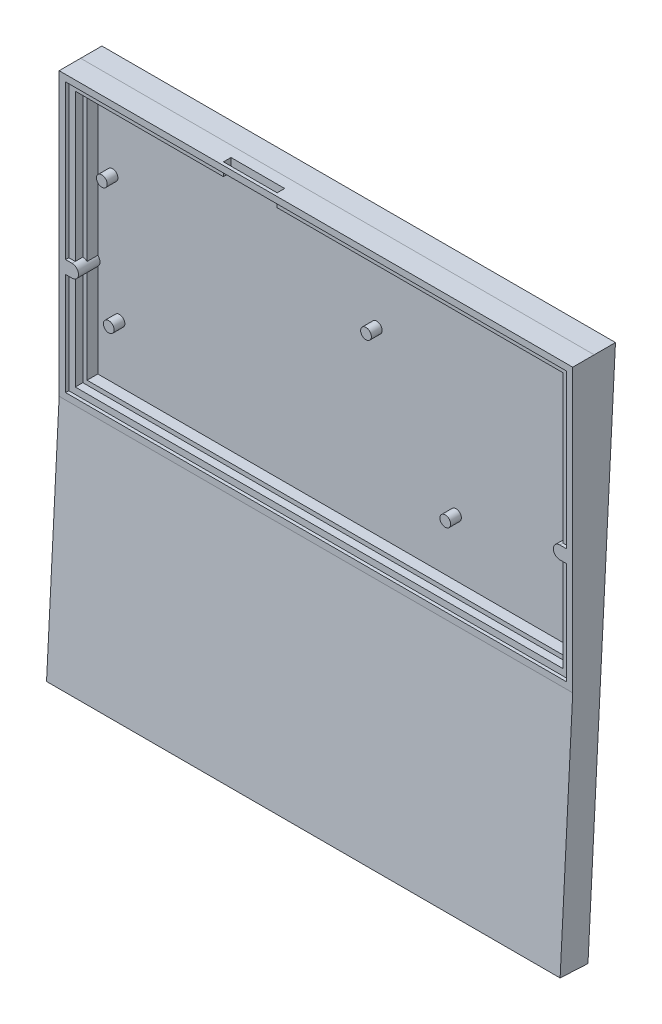
from build123d import *

# Parameters (mm, degrees)
MODEL_W             = 239.114
MODEL_H             = 131.298938207
EXTRUDE_2_DEPTH     = 10
EXTRUDE_3_DEPTH     = 8.5
EXTRUDE_4_DEPTH     = 5
SKETCH_3_R          = 2.5
EXTRUDE_5_DEPTH     = 5
EXTRUDE_5_2_DEPTH   = 5
EXTRUDE_5_3_DEPTH   = 5
EXTRUDE_5_4_DEPTH   = 5
EXTRUDE_6_DEPTH     = 239.114
SKETCH_5_W          = 25
SKETCH_5_H          = 5.998631207
CUT_EXTRUDE_1_DEPTH = 3.5


with BuildPart() as part:
    # Model → 凸台-拉伸2 (new body)
    with BuildSketch(Plane.XY):
        with Locations((559.31883528, 226.885059923)):
            Rectangle(MODEL_W, MODEL_H)
        with BuildLine():
            Line((442.76183528, 289.535897819), (675.87583528, 289.535897819))
            Line((675.87583528, 289.535897819), (675.87583528, 217.861297819))
            Line((675.87583528, 217.861297819), (672.87583528, 217.861297819))
            ThreePointArc((672.87583528, 217.861297819), (671.805369011, 217.663814896), (670.87583528, 217.097365797))
            ThreePointArc((670.87583528, 217.097365797), (669.87583528, 214.861297819), (670.87583528, 212.625229842))
            ThreePointArc((670.87583528, 212.625229842), (671.805369011, 212.058780742), (672.87583528, 211.861297819))
            Line((672.87583528, 211.861297819), (675.87583528, 211.861297819))
            Line((675.87583528, 211.861297819), (675.87583528, 164.235590819))
            Line((675.87583528, 164.235590819), (442.76183528, 164.235590819))
            Line((442.76183528, 164.235590819), (442.76183528, 211.861297819))
            Line((442.76183528, 211.861297819), (445.76183528, 211.861297819))
            ThreePointArc((445.76183528, 211.861297819), (446.832301549, 212.058780742), (447.76183528, 212.625229842))
            ThreePointArc((447.76183528, 212.625229842), (448.76183528, 214.861297819), (447.76183528, 217.097365797))
            ThreePointArc((447.76183528, 217.097365797), (446.832301549, 217.663814896), (445.76183528, 217.861297819))
            Line((445.76183528, 217.861297819), (442.76183528, 217.861297819))
            Line((442.76183528, 217.861297819), (442.76183528, 289.535897819))
        make_face(mode=Mode.SUBTRACT)
    extrude(amount=EXTRUDE_2_DEPTH)

    # Model<4> → 凸台-拉伸3 (add)
    with BuildSketch(Plane.XY):
        Polygon((445.76183528, 167.235590819), (445.76183528, 211.861297819), (442.76183528, 211.861297819), (442.76183528, 164.235590819), (675.87583528, 164.235590819), (675.87583528, 211.861297819), (672.87583528, 211.861297819), (672.87583528, 167.235590819), align=None)
        Polygon((442.76183528, 217.861297819), (442.76183528, 289.535897819), (675.87583528, 289.535897819), (675.87583528, 217.861297819), (672.87583528, 217.861297819), (672.87583528, 286.535897819), (445.76183528, 286.535897819), (445.76183528, 217.861297819), align=None)
    extrude(amount=EXTRUDE_3_DEPTH)

    # Model<5> → 凸台-拉伸4 (add)
    with BuildSketch(Plane.XY):
        with BuildLine():
            ThreePointArc((672.87583528, 211.861297819), (671.805369011, 212.058780742), (670.87583528, 212.625229842))
            Line((670.87583528, 212.625229842), (670.87583528, 169.235590819))
            Line((670.87583528, 169.235590819), (447.76183528, 169.235590819))
            Line((447.76183528, 169.235590819), (447.76183528, 212.625229842))
            ThreePointArc((447.76183528, 212.625229842), (446.832301549, 212.058780742), (445.76183528, 211.861297819))
            Line((445.76183528, 211.861297819), (445.76183528, 167.235590819))
            Line((445.76183528, 167.235590819), (672.87583528, 167.235590819))
            Line((672.87583528, 167.235590819), (672.87583528, 211.861297819))
        make_face()
        with BuildLine():
            ThreePointArc((670.87583528, 217.097365797), (671.805369011, 217.663814896), (672.87583528, 217.861297819))
            Line((672.87583528, 217.861297819), (672.87583528, 286.535897819))
            Line((672.87583528, 286.535897819), (539.76183528, 286.535897819))
            Line((539.76183528, 286.535897819), (514.76183528, 286.535897819))
            Line((514.76183528, 286.535897819), (445.76183528, 286.535897819))
            Line((445.76183528, 286.535897819), (445.76183528, 217.861297819))
            ThreePointArc((445.76183528, 217.861297819), (446.832301549, 217.663814896), (447.76183528, 217.097365797))
            Line((447.76183528, 217.097365797), (447.76183528, 284.535897819))
            Line((447.76183528, 284.535897819), (670.87583528, 284.535897819))
            Line((670.87583528, 284.535897819), (670.87583528, 217.097365797))
        make_face()
    extrude(amount=EXTRUDE_4_DEPTH)



with BuildPart() as body_2:
    # 草图3 → 凸台-拉伸5 (new body)
    with BuildSketch(Plane(origin=(0, 0, 0), x_dir=(-1, 0, 0), z_dir=(0, 0, -1))):
        with Locations((-577.62472278, 252.961297819)):
            Circle(SKETCH_3_R)
    extrude(amount=-EXTRUDE_5_DEPTH)


with BuildPart() as body_3:
    # 草图3 → Extrude 5 2 (new body)
    with BuildSketch(Plane(origin=(0, 0, 0), x_dir=(-1, 0, 0), z_dir=(0, 0, -1))):
        with Locations((-614.53372278, 195.811572819)):
            Circle(SKETCH_3_R)
    extrude(amount=-EXTRUDE_5_2_DEPTH)


with BuildPart() as body_4:
    # 草图3 → Extrude 5 3 (new body)
    with BuildSketch(Plane(origin=(0, 0, 0), x_dir=(-1, 0, 0), z_dir=(0, 0, -1))):
        with Locations((-457.84983528, 195.811597819)):
            Circle(SKETCH_3_R)
    extrude(amount=-EXTRUDE_5_3_DEPTH)


with BuildPart() as body_5:
    # 草图3 → Extrude 5 4 (new body)
    with BuildSketch(Plane(origin=(0, 0, 0), x_dir=(-1, 0, 0), z_dir=(0, 0, -1))):
        with Locations((-454.62472278, 252.961297819)):
            Circle(SKETCH_3_R)
    extrude(amount=-EXTRUDE_5_4_DEPTH)


with BuildPart() as part_1:
    add(part.part)

    add(body_2.part)  # 凸台-拉伸6 merges body 2

    add(body_3.part)  # 凸台-拉伸6 merges body 3

    add(body_4.part)  # 凸台-拉伸6 merges body 4

    add(body_5.part)  # 凸台-拉伸6 merges body 5
    # 草图4 → 凸台-拉伸6 (add)
    with BuildSketch(Plane.ZY.offset(-439.76183528)):
        Polygon((-9.898975205, 292.535462726), (2.890322341, 48.501128108), (15.872506293, 49.181495539), (10, 161.235590819), (0, 161.235590819), (0, 292.534529026), align=None)
    extrude(amount=-EXTRUDE_6_DEPTH)

    # 草图5 → 切除-拉伸1 (cut)
    with BuildSketch(Plane.XY.offset(8.5)):
        with Locations((527.26183528, 289.535213423)):
            Rectangle(SKETCH_5_W, SKETCH_5_H)
    extrude(amount=-CUT_EXTRUDE_1_DEPTH, mode=Mode.SUBTRACT)


solid = part_1.part
